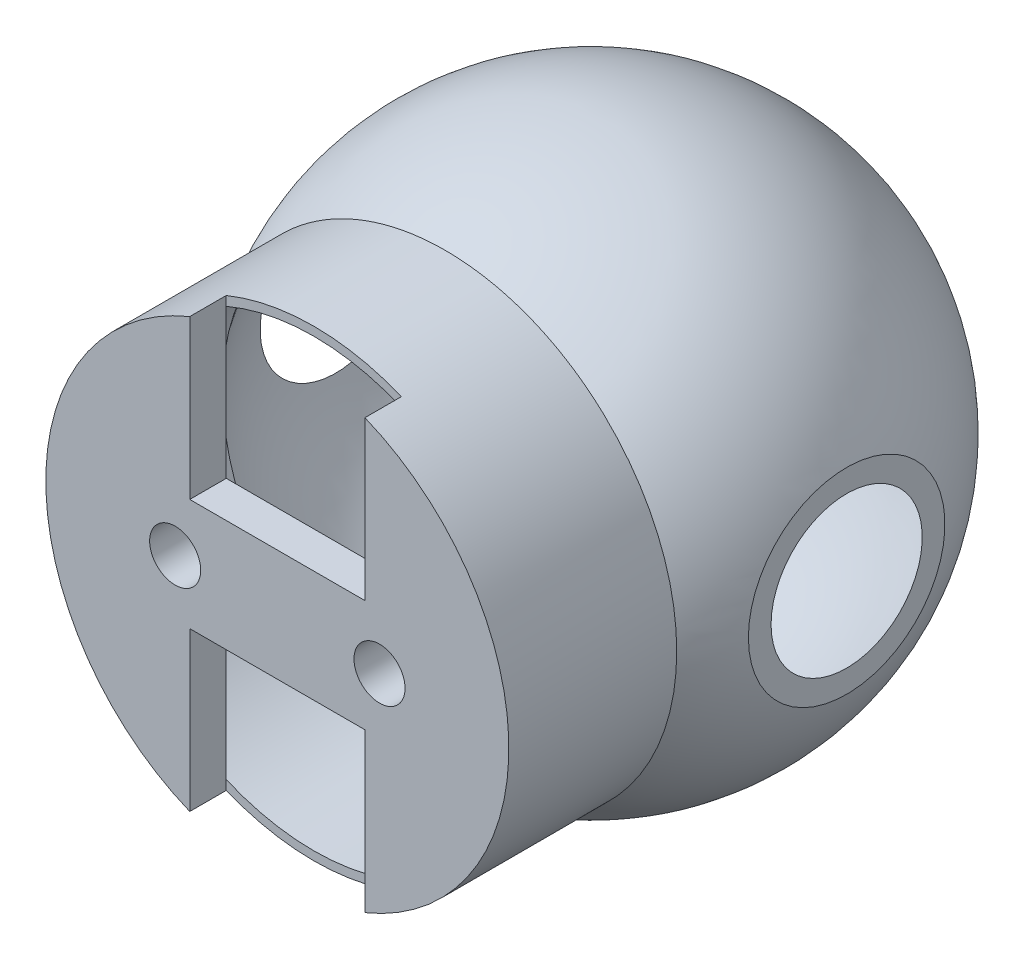
from build123d import *
from build123d.topology import SkipClean

# Parameters (mm, degrees)
CUT_EXTRUDE1_REACH  = 80.222
SKETCH2_R           = 37.5
CUT_EXTRUDE2_REACH  = 91.826
SKETCH4_R           = 37.5
SKETCH5_R           = 31.721443851
SKETCH5_R_2         = 30.532769282
BOSS_EXTRUDE1_DEPTH = 18
SKETCH6_R           = 3.5
BOSS_EXTRUDE2_DEPTH = 5


with BuildPart() as part:
    # Sketch1 → Revolve-Thin4 (revolve)
    with BuildSketch(Plane.XY):
        with BuildLine():
            ThreePointArc((0, -37.5), (37.5, 0), (0, 37.5))
            Line((0, 37.5), (0, 36.5))
            ThreePointArc((0, 36.5), (36.5, 0), (0, -36.5))
            Line((0, -36.5), (0, -37.5))
        make_face()
    revolve(axis=Axis((0, 37.5, 0), (0, -1, 0)))

    # Sketch2 → Cut-Extrude1 (cut, up to next)
    with BuildSketch(Plane.XY.offset(20), mode=Mode.PRIVATE) as cut_extrude1_sk1:
        Circle(SKETCH2_R)
    cut_extrude1_tool1 = extrude(cut_extrude1_sk1.sketch, amount=CUT_EXTRUDE1_REACH, mode=Mode.PRIVATE) & part.part
    add(cut_extrude1_tool1.solids().sort_by_distance((0, 0, 20))[0], mode=Mode.SUBTRACT)

    # Sketch4 → Cut-Extrude2 (cut, up to next)
    with BuildSketch(Plane(origin=(-35, 0, 0), x_dir=(0, 0, -1), z_dir=(1, 0, 0)), mode=Mode.PRIVATE) as cut_extrude2_sk1:
        Circle(SKETCH4_R)
    cut_extrude2_tool1 = extrude(cut_extrude2_sk1.sketch, amount=-CUT_EXTRUDE2_REACH, mode=Mode.PRIVATE) & part.part
    cut_extrude2 = cut_extrude2_tool1.solids().sort_by_distance((-35, 0, 0))[0]
    add(cut_extrude2, mode=Mode.SUBTRACT)

    # Mirror1: Cut-Extrude2 across plane
    add(cut_extrude2.mirror(Plane(origin=(0, 0, 0), x_dir=(0, 0, 1), z_dir=(1, 0, 0))), mode=Mode.SUBTRACT)

    # Sketch5 → Boss-Extrude1 (add)
    with SkipClean():  # the faces are left unmerged after this step: merging them gives an invalid solid
        with BuildSketch(Plane.XY.offset(20)):
            Circle(SKETCH5_R)
            Circle(SKETCH5_R_2, mode=Mode.SUBTRACT)
        extrude(amount=BOSS_EXTRUDE1_DEPTH)

    # Sketch6 → Boss-Extrude2 (add)
    with SkipClean():  # the faces are left unmerged after this step: merging them gives an invalid solid
        with BuildSketch(Plane.XY.offset(38)):
            with BuildLine():
                Line((-12, 29.36409372), (-12, 7.663369949))
                Line((-12, 7.663369949), (12, 7.663369949))
                Line((12, 7.663369949), (12, 29.36409372))
                ThreePointArc((12, 29.36409372), (31.721443851, 0), (12, -29.36409372))
                Line((12, -29.36409372), (12, -7.663369949))
                Line((12, -7.663369949), (-12, -7.663369949))
                Line((-12, -7.663369949), (-12, -29.36409372))
                ThreePointArc((-12, -29.36409372), (-31.721443851, 0), (-12, 29.36409372))
            make_face()
            with Locations((14, 0)):
                Circle(SKETCH6_R, mode=Mode.SUBTRACT)
            with Locations(Location((-14, 0, 0), (0, 0, 180))):
                Circle(SKETCH6_R, mode=Mode.SUBTRACT)
        extrude(amount=BOSS_EXTRUDE2_DEPTH)


solid = part.part
